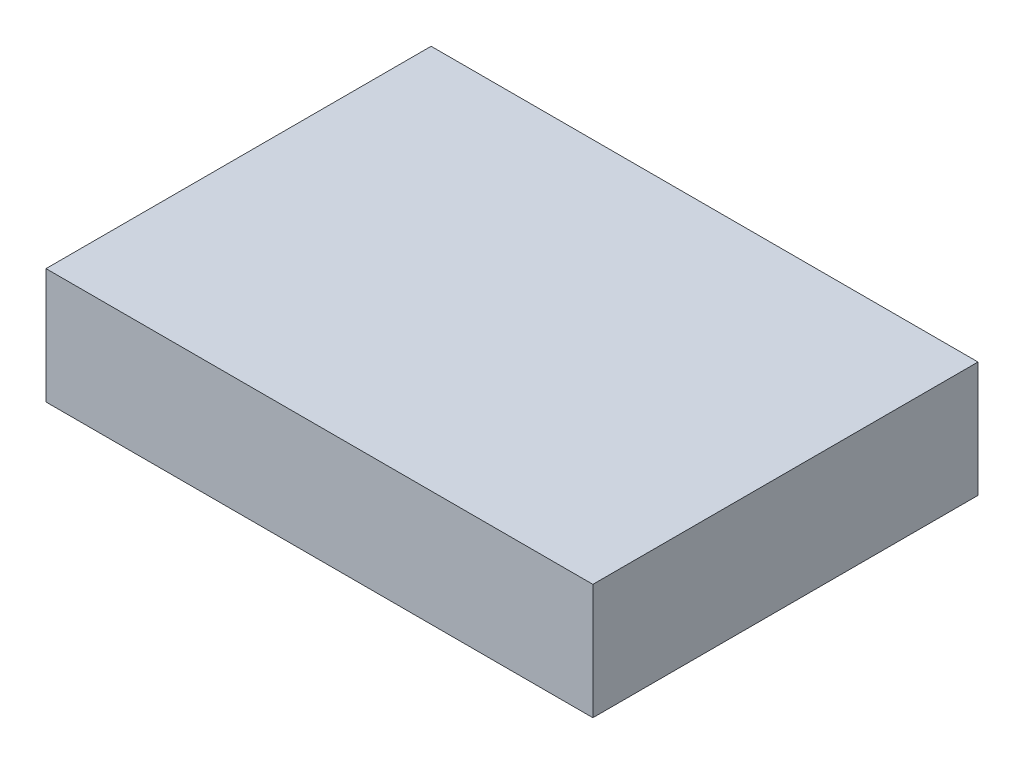
from build123d import *

# Parameters (mm, degrees)
SKETCH_1_W      = 71
SKETCH_1_H      = 50
EXTRUDE_1_DEPTH = 15


with BuildPart() as part:
    # 草图1 → 凸台-拉伸1 (new body)
    with BuildSketch(Plane(origin=(0, 0, 0), x_dir=(1, 0, 0), z_dir=(0, 1, 0))):
        with Locations((35.5, -25)):
            Rectangle(SKETCH_1_W, SKETCH_1_H)
    extrude(amount=EXTRUDE_1_DEPTH)


solid = part.part
